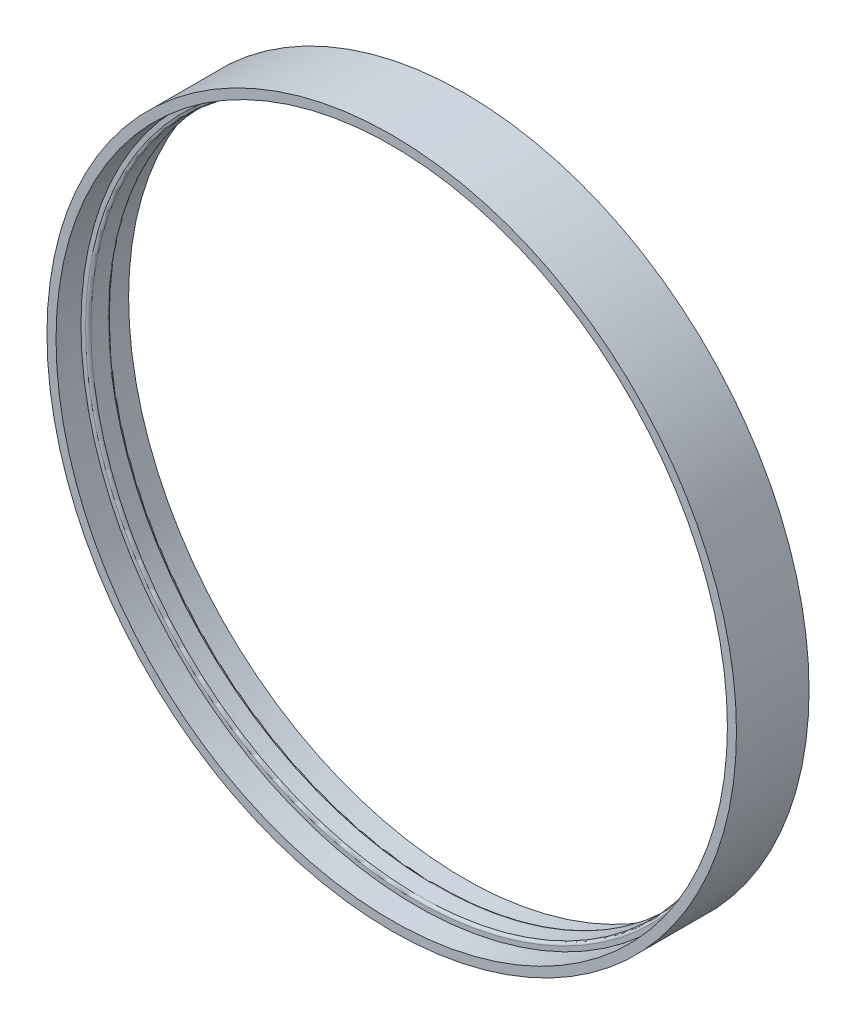
from build123d import *


with BuildPart() as part:
    # Sketch2 → Revolve1 (revolve)
    with BuildSketch(Plane(origin=(0, 0, 0), x_dir=(0, 0, -1), z_dir=(1, 0, 0)), mode=Mode.PRIVATE) as revolve1_sk:
        with BuildLine():
            Line((-3.175, 93.98), (-3.175, 92.71))
            ThreePointArc((-3.175, 92.71), (-2.951815367, 92.171184633), (-2.413, 91.948))
            Line((-2.413, 91.948), (2.413, 91.948))
            ThreePointArc((2.413, 91.948), (2.951815367, 92.171184633), (3.175, 92.71))
            Line((3.175, 92.71), (3.175, 93.98))
            Line((3.175, 93.98), (10.16, 93.98))
            Line((10.16, 93.98), (10.16, 96.52))
            Line((10.16, 96.52), (-10.16, 96.52))
            Line((-10.16, 96.52), (-10.16, 93.98))
            Line((-10.16, 93.98), (-3.175, 93.98))
        make_face()
    revolve(revolve1_sk.sketch.rotate(Axis((0, 0, -11.176), (0, 0, 1)), 90), axis=Axis((0, 0, -11.176), (0, 0, 1)))


solid = part.part
